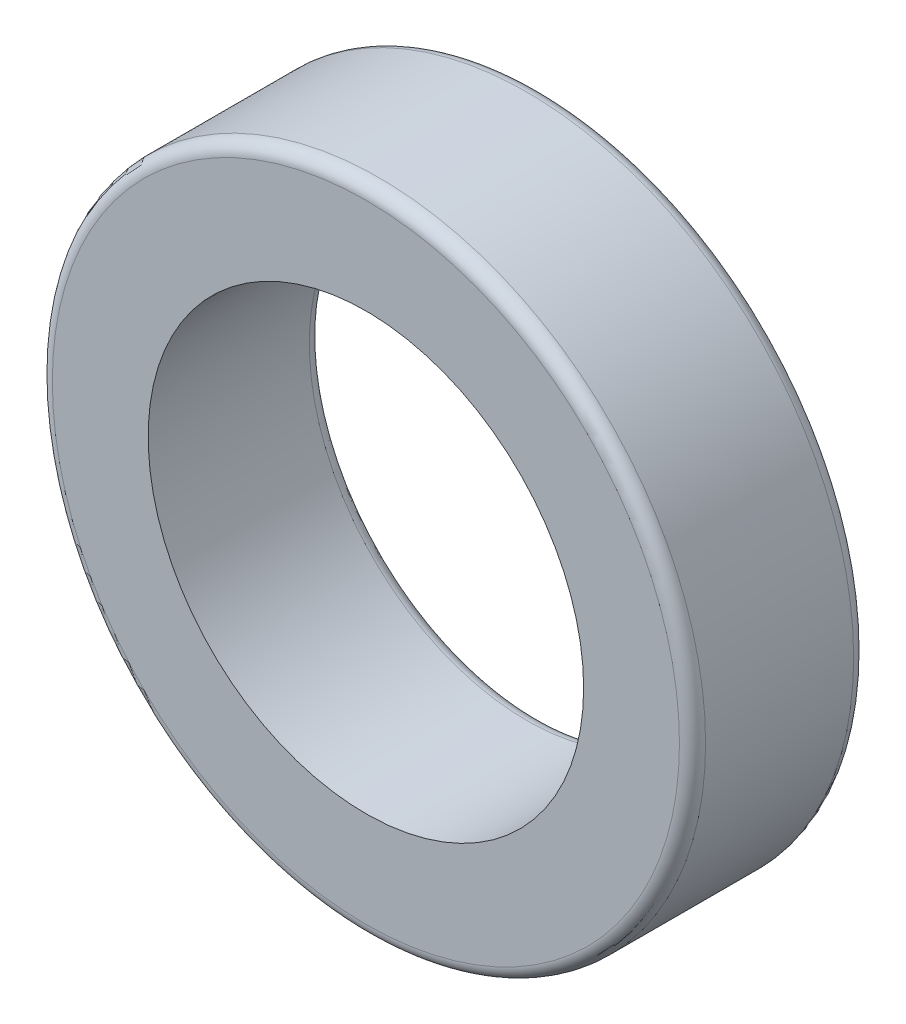
from build123d import *

# Parameters (mm, degrees)
SKETCH1_R           = 7.5
SKETCH1_R_2         = 5
BOSS_EXTRUDE1_DEPTH = 2
FILLET2_R           = 0.3


with BuildPart() as part:
    # Sketch1 → Boss-Extrude1 (new, symmetric)
    with BuildSketch(Plane.XY):
        Circle(SKETCH1_R)
        Circle(SKETCH1_R_2, mode=Mode.SUBTRACT)
    extrude(amount=BOSS_EXTRUDE1_DEPTH, both=True)

    # Fillet2
    fillet2_edges = [part.edges().sort_by_distance(p)[0] for p in [
        (-7.5, 0, -2),
        (-7.5, 0, 2),
        (-5, 0, -2),
    ]]
    fillet(fillet2_edges, radius=FILLET2_R)


solid = part.part
